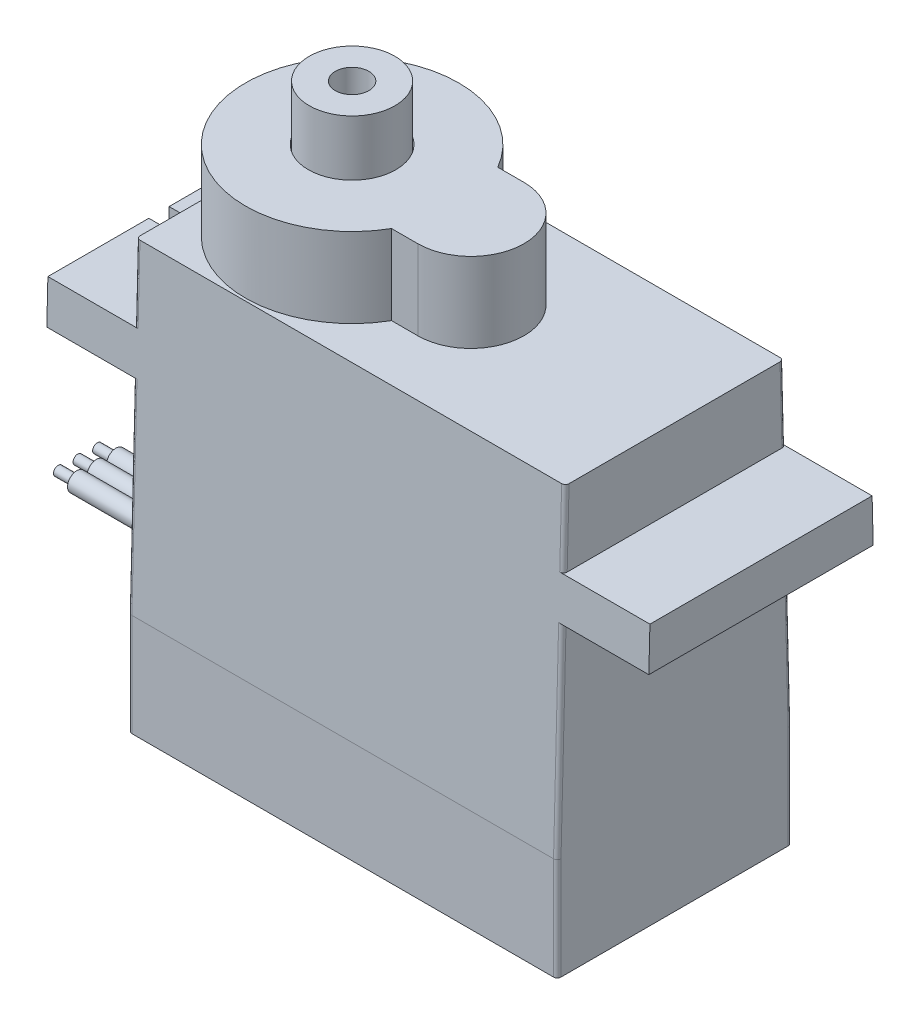
from build123d import *

# Parameters (mm, degrees)
BOSS_EXTRUDE1_DEPTH      = 6.295
BOSS_EXTRUDE2_DEPTH      = 4.28
CUT_EXTRUDE4_DEPTH       = 37.749948639
SKETCH4_R                = 0.975
SKETCH4_W                = 1.511544683
SKETCH4_H                = 1.09
CUT_EXTRUDE1_DEPTH       = 27.991002668
SKETCH5_R                = 1
SKETCH5_R_2              = 0.975
CUT_EXTRUDE2_DEPTH       = 1
SKETCH6_R                = 0.5
BOSS_EXTRUDE4_DEPTH      = 8
SKETCH7_R                = 0.25
BOSS_EXTRUDE5_DEPTH      = 1
FILLET1_R                = 0.3
FILLET3_R                = 0.2
BOSS_EXTRUDE6_DEPTH      = 2.95
BOSS_EXTRUDE6_DEPTH_BACK = 1
SKETCH12_R               = 2.3
SKETCH12_R_2             = 0.9
SKETCH13_R               = 2.35
CUT_EXTRUDE5_DEPTH       = 5


with BuildPart() as part:
    # Sketch1 → Boss-Extrude1 (new, symmetric)
    with BuildSketch(Plane.XY):
        Polygon((-7.13, 6.38), (15.9, 6.38), (15.9, 2.32), (20.54, 2.32), (20.54, 0), (15.9, 0), (15.9, -16.34), (-7.13, -16.34), (-7.13, 0), (-11.77, 0), (-11.77, 2.32), (-7.13, 2.32), align=None)
    extrude(amount=BOSS_EXTRUDE1_DEPTH, both=True)

    # Sketch2 → Boss-Extrude2 (add)
    with BuildSketch(Plane(origin=(0, 6.38, 0), x_dir=(1, 0, 0), z_dir=(0, 1, 0))):
        with BuildLine():
            Line((3.560191336, -2.85), (4.97, -2.85))
            ThreePointArc((4.97, -2.85), (7.82, 0), (4.97, 2.85))
            Line((4.97, 2.85), (3.560191336, 2.85))
            ThreePointArc((3.560191336, 2.85), (-7.13, 0), (3.560191336, -2.85))
        make_face()
    extrude(amount=BOSS_EXTRUDE2_DEPTH)

    # Sketch11 → Cut-Extrude4 (cut, through all)
    with BuildSketch(Plane.ZY.offset(11.77)):
        Polygon((-5.86, 6.38), (-6.295, -10.84), (-6.295, 6.38), align=None)
    cut_extrude4 = extrude(amount=-CUT_EXTRUDE4_DEPTH, mode=Mode.SUBTRACT)

    # Mirror1: Cut-Extrude4 across plane
    add(cut_extrude4.mirror(Plane.XY), mode=Mode.SUBTRACT)

    # Sketch4 → Cut-Extrude1 (cut, through all)
    with BuildSketch(Plane(origin=(0, 0, 0), x_dir=(1, 0, 0), z_dir=(0, 1, 0))):
        with Locations((-9.45, 0)):
            Circle(SKETCH4_R)
        with Locations((-11.014227659, 0)):
            Rectangle(SKETCH4_W, SKETCH4_H)
    extrude(amount=CUT_EXTRUDE1_DEPTH, mode=Mode.SUBTRACT)

    # Sketch5 → Cut-Extrude2 (cut)
    # profile 1 of 4: a face of its own
    with BuildSketch(Plane.XZ.offset(16.34)):
        with Locations((-5.49, 4.35)):
            Circle(SKETCH5_R)
        with Locations((-5.49, 4.35)):
            Circle(SKETCH5_R_2, mode=Mode.SUBTRACT)
    # profile 2 of 4: a face of its own
    with BuildSketch(Plane.XZ.offset(16.34)):
        with Locations((-5.49, -4.35)):
            Circle(SKETCH5_R)
        with Locations((-5.49, -4.35)):
            Circle(SKETCH5_R_2, mode=Mode.SUBTRACT)
    # profile 3 of 4: a face of its own
    with BuildSketch(Plane.XZ.offset(16.34)):
        with Locations((14.26, -4.35)):
            Circle(SKETCH5_R)
        with Locations((14.26, -4.35)):
            Circle(SKETCH5_R_2, mode=Mode.SUBTRACT)
    # profile 4 of 4: a face of its own
    with BuildSketch(Plane.XZ.offset(16.34)):
        with Locations((14.26, 4.35)):
            Circle(SKETCH5_R)
        with Locations((14.26, 4.35)):
            Circle(SKETCH5_R_2, mode=Mode.SUBTRACT)
    extrude(amount=-CUT_EXTRUDE2_DEPTH, mode=Mode.SUBTRACT)

    # Sketch6 → Boss-Extrude4 (add)
    with BuildSketch(Plane.ZY.offset(7.13)):
        with Locations((0, -11.34)):
            Circle(SKETCH6_R)
        with Locations((1.05, -11.34)):
            Circle(SKETCH6_R)
        with Locations((-1.05, -11.34)):
            Circle(SKETCH6_R)
    extrude(amount=BOSS_EXTRUDE4_DEPTH)

    # Sketch7 → Boss-Extrude5 (add)
    with BuildSketch(Plane.ZY.offset(15.13)):
        with Locations((0, -11.34)):
            Circle(SKETCH7_R)
        with Locations((1.05, -11.34)):
            Circle(SKETCH7_R)
        with Locations((-1.05, -11.34)):
            Circle(SKETCH7_R)
    extrude(amount=BOSS_EXTRUDE5_DEPTH)

    # Fillet1
    fillet1_edges = [part.edges().sort_by_distance(p)[0] for p in [
        (13.285, -16.34, -4.35),
        (13.285, -16.34, 4.35),
        (-6.465, -16.34, -4.35),
        (-6.465, -16.34, 4.35),
    ]]
    fillet(fillet1_edges, radius=FILLET1_R)

    # Fillet3
    fillet3_edges = [part.edges().sort_by_distance(p)[0] for p in [
        (15.9, -13.59, -6.295),
        (15.9, -13.59, 6.295),
        (-7.13, -13.59, -6.295),
        (-7.13, -13.59, 6.295),
        (-7.13, -5.42, 6.158083624),
        (-7.13, -5.42, -6.158083624),
        (15.9, -5.42, 6.158083624),
        (15.9, -5.42, -6.158083624),
        (15.9, 4.35, -5.911280488),
        (15.9, 4.35, 5.911280488),
        (-7.13, 4.35, -5.911280488),
        (-7.13, 4.35, 5.911280488),
    ]]
    fillet(fillet3_edges, radius=FILLET3_R)

    # Sketch13 → Cut-Extrude5 (cut)
    with BuildSketch(Plane(origin=(0, 13.61, 0), x_dir=(1, 0, 0), z_dir=(0, 1, 0))):
        with Locations((-1.405, 0)):
            Circle(SKETCH13_R)
    extrude(amount=-CUT_EXTRUDE5_DEPTH, mode=Mode.SUBTRACT)


with BuildPart() as body_2:
    # Sketch12 → Boss-Extrude6 (new, two sides: drawn at the far end of the back side and taken through both)
    with BuildSketch(Plane(origin=(0, 10.66, 0), x_dir=(1, 0, 0), z_dir=(0, 1, 0)).offset(-BOSS_EXTRUDE6_DEPTH_BACK)):
        with Locations((-1.405, 0)):
            Circle(SKETCH12_R)
        with Locations((-1.405, 0)):
            Circle(SKETCH12_R_2, mode=Mode.SUBTRACT)
    extrude(amount=BOSS_EXTRUDE6_DEPTH + BOSS_EXTRUDE6_DEPTH_BACK)


solid = Compound([part.part, body_2.part])
